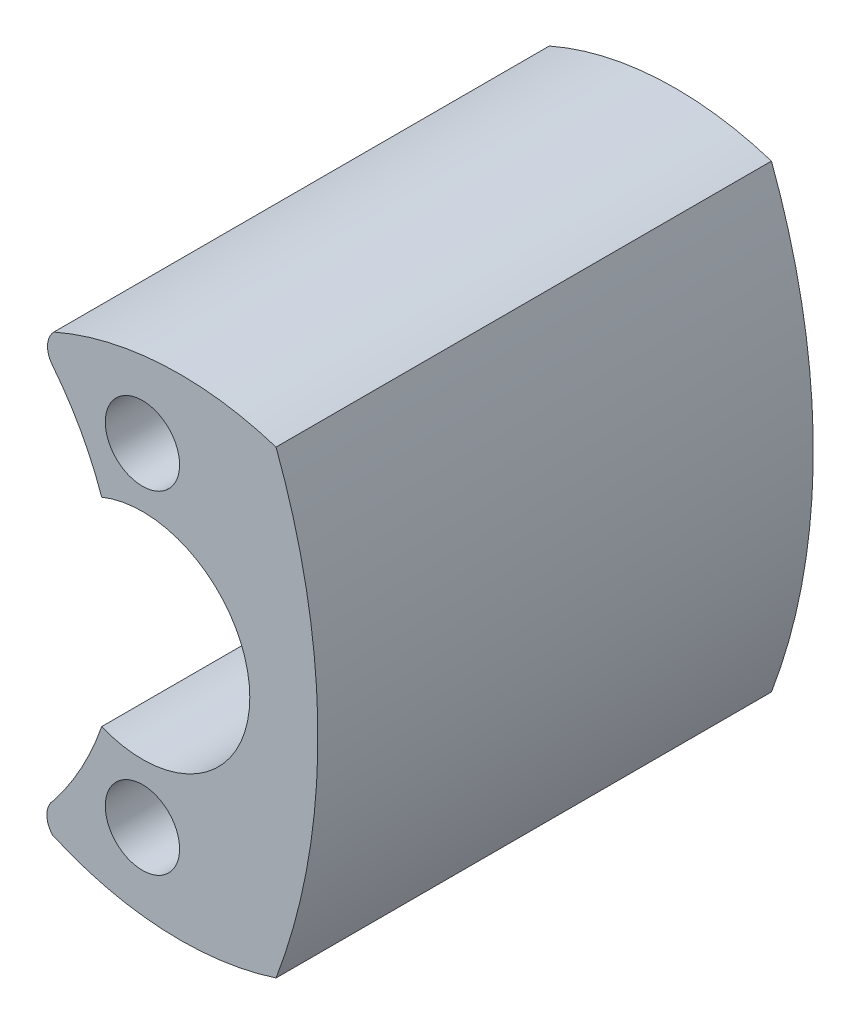
from build123d import *

# Parameters (mm, degrees)
EXTRUDE1_DEPTH      = 20
EXTRUDE1_DEPTH_BACK = 0.001
SKETCH3_R           = 1.5
CUT_EXTRUDE1_DEPTH  = 24.410598845
SKETCH5_R           = 4.335
CUT_EXTRUDE2_DEPTH  = 24


with BuildPart() as part:
    # Sketch1 → Extrude1 (new, two sides: drawn at the far end of the back side and taken through both)
    with BuildSketch(Plane.XY.offset(-EXTRUDE1_DEPTH_BACK)):
        with BuildLine():
            ThreePointArc((5.394294709, 9.281673418), (7.083207262, 0), (5.394294709, -9.281673418))
            ThreePointArc((5.394294709, -9.281673418), (0.839593343, -9.873480825), (-3.625620963, -8.797654747))
            ThreePointArc((-3.625620963, -8.797654747), (-3.857898862, -8.166383103), (-3.57576768, -7.555761366))
            ThreePointArc((-3.57576768, -7.555761366), (-0.970954643, 0.05080099), (-3.638712866, 7.635516404))
            ThreePointArc((-3.638712866, 7.635516404), (-3.831936153, 8.239573474), (-3.57576768, 8.819744049))
            ThreePointArc((-3.57576768, 8.819744049), (0.866819678, 9.874912356), (5.394294709, 9.281673418))
        make_face()
    extrude(amount=EXTRUDE1_DEPTH + EXTRUDE1_DEPTH_BACK)

    # Sketch3 → Cut-Extrude1 (cut, through all)
    with BuildSketch(Plane.XY.offset(20)):
        with Locations((0, 6.715)):
            Circle(SKETCH3_R)
        with Locations(Location((0, -6.715, 0), (0, 0, 180))):
            Circle(SKETCH3_R)
    extrude(amount=-CUT_EXTRUDE1_DEPTH, mode=Mode.SUBTRACT)

    # Sketch5 → Cut-Extrude2 (cut)
    with BuildSketch(Plane(origin=(0, 0, -0.001), x_dir=(-1, 0, 0), z_dir=(0, 0, -1))):
        Circle(SKETCH5_R)
    extrude(amount=-CUT_EXTRUDE2_DEPTH, mode=Mode.SUBTRACT)


solid = part.part
